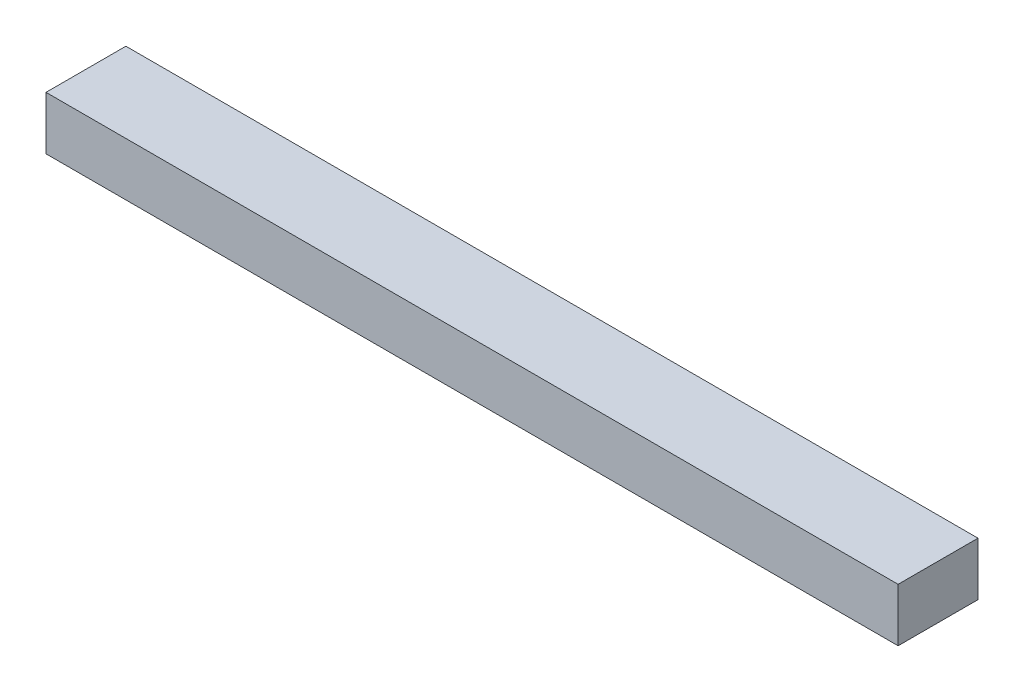
from build123d import *

# Parameters (mm, degrees)
SKETCH1_W           = 320
SKETCH1_H           = 30
BOSS_EXTRUDE1_DEPTH = 20


with BuildPart() as part:
    # Sketch1 → Boss-Extrude1 (new body)
    with BuildSketch(Plane(origin=(0, 0, 0), x_dir=(1, 0, 0), z_dir=(0, 1, 0))):
        Rectangle(SKETCH1_W, SKETCH1_H)
    extrude(amount=BOSS_EXTRUDE1_DEPTH)


solid = part.part
